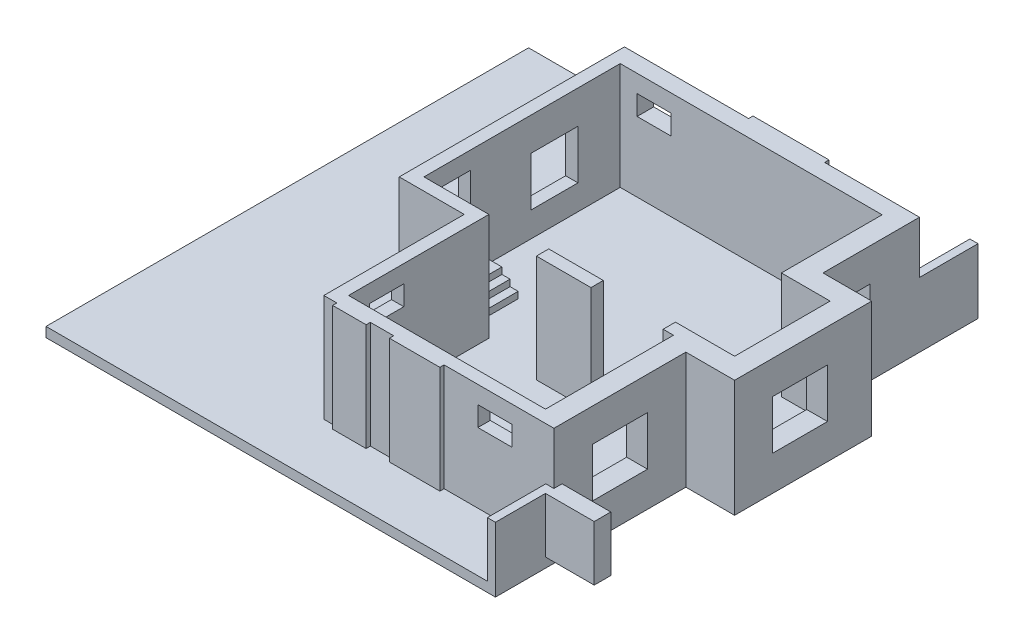
from build123d import *

# Parameters (mm, degrees)
EXTRUDE_1_DEPTH     = 3300
SKETCH_1_W          = 1680
SKETCH_1_H          = 380
EXTRUDE_1_2_DEPTH   = 3300
SKETCH_3_W          = 250
SKETCH_3_H          = 1800
EXTRUDE_2_DEPTH     = 1695
EXTRUDE_3_DEPTH     = 300
SKETCH_5_W          = 1310
SKETCH_5_H          = 2100
SKETCH_5_W_2        = 1440
SKETCH_5_H_2        = 1510
CUT_EXTRUDE_1_DEPTH = 380
SKETCH_6_W          = 1400
SKETCH_6_H          = 1500
EXTRUDE_4_DEPTH     = 200
SKETCH_7_W          = 1150
SKETCH_7_H          = 1500
EXTRUDE_5_DEPTH     = 200
SKETCH_8_W          = 900
SKETCH_8_H          = 1500
EXTRUDE_6_DEPTH     = 200
SKETCH_9_W          = 1440
SKETCH_9_H          = 1510
CUT_EXTRUDE_2_DEPTH = 640
SKETCH_10_W         = 1700
SKETCH_10_H         = 1510
CUT_EXTRUDE_3_DEPTH = 640
SKETCH_11_W         = 1050
SKETCH_11_H         = 610
CUT_EXTRUDE_4_DEPTH = 510
SKETCH_12_W         = 1050
SKETCH_12_H         = 610
CUT_EXTRUDE_5_DEPTH = 380
SKETCH_13_W         = 1050
SKETCH_13_H         = 610
CUT_EXTRUDE_6_DEPTH = 380
SKETCH_14_W         = 1700
SKETCH_14_H         = 1510
CUT_EXTRUDE_7_DEPTH = 640
SKETCH_15_R         = 54
SKETCH_15_R_2       = 38
SKETCH_15_R_3       = 136.5
SKETCH_15_R_4       = 109.5
CUT_EXTRUDE_8_DEPTH = 300


with BuildPart() as part:
    # Эскиз1 → Бобышка-Вытянуть1 (new body)
    with BuildSketch(Plane(origin=(0, 0, 0), x_dir=(1, 0, 0), z_dir=(0, 1, 0))):
        Polygon((-6440, 255), (-10260, 255), (-10260, -6675), (-8260, -6675), (-8260, -10995), (-7860, -10995), (-7860, -11125), (-6830, -11125), (-6830, -10995), (-6110, -10995), (-6110, -11125), (-4560, -11125), (-4560, -10995), (-1180, -10995), (-1180, -6935), (320, -6935), (320, -2715), (-1180, -2715), (-1180, 255), (-4100, 255), (-4100, 390), (-6440, 390), align=None)
        Polygon((-7880, -10615), (-7880, -6675), (-7880, -6295), (-9880, -6295), (-9880, -255), (-1820, -255), (-1820, -3355), (-320, -3355), (-320, -6295), (-2140, -6295), (-2140, -6675), (-1820, -6675), (-1820, -10615), align=None, mode=Mode.SUBTRACT)
    extrude(amount=EXTRUDE_1_DEPTH)

    # Эскиз3 → Бобышка-Вытянуть2 (add)
    with BuildSketch(Plane(origin=(0, 0, 0), x_dir=(1, 0, 0), z_dir=(0, 1, 0))):
        with Locations((-1305, -11895)):
            Rectangle(SKETCH_3_W, SKETCH_3_H)
        Polygon((-1180, -10745), (-1180, -10995), (-1180, -11255), (320, -11255), (320, -10745), align=None)
        with Locations((-1305, 1155)):
            Rectangle(SKETCH_3_W, SKETCH_3_H)
    extrude(amount=EXTRUDE_2_DEPTH)

    # Эскиз4 → Бобышка-Вытянуть3 (add)
    with BuildSketch(Plane(origin=(0, 0, 0), x_dir=(1, 0, 0), z_dir=(0, 1, 0))):
        Polygon((-1180, 2055), (-1180, -2715), (320, -2715), (320, -6935), (-1180, -6935), (-1180, -12795), (-15010, -12795), (-15010, 2055), align=None)
    extrude(amount=-EXTRUDE_3_DEPTH)

    # Эскиз5 → Вырез-Вытянуть1 (cut)
    with BuildSketch(Plane(origin=(-9880, 0, 0), x_dir=(0, 0, -1), z_dir=(1, 0, 0))):
        with Locations((-5510, 1710)):
            Rectangle(SKETCH_5_W, SKETCH_5_H)
        with Locations((-2275, 1525)):
            Rectangle(SKETCH_5_W_2, SKETCH_5_H_2)
    extrude(amount=-CUT_EXTRUDE_1_DEPTH, mode=Mode.SUBTRACT)

    # Эскиз6 → Бобышка-Вытянуть4 (add)
    with BuildSketch(Plane(origin=(0, 0, 0), x_dir=(1, 0, 0), z_dir=(0, 1, 0))):
        with Locations((-9180, -5545)):
            Rectangle(SKETCH_6_W, SKETCH_6_H)
    extrude(amount=EXTRUDE_4_DEPTH)

    # Эскиз7 → Бобышка-Вытянуть5 (add)
    with BuildSketch(Plane(origin=(0, 200, 0), x_dir=(1, 0, 0), z_dir=(0, 1, 0))):
        with Locations((-9305, -5545)):
            Rectangle(SKETCH_7_W, SKETCH_7_H)
    extrude(amount=EXTRUDE_5_DEPTH)

    # Эскиз8 → Бобышка-Вытянуть6 (add)
    with BuildSketch(Plane(origin=(0, 400, 0), x_dir=(1, 0, 0), z_dir=(0, 1, 0))):
        with Locations((-9430, -5545)):
            Rectangle(SKETCH_8_W, SKETCH_8_H)
    extrude(amount=EXTRUDE_6_DEPTH)

    # Эскиз9 → Вырез-Вытянуть2 (cut)
    with BuildSketch(Plane.ZY.offset(1820)):
        with Locations((1995, 1525)):
            Rectangle(SKETCH_9_W, SKETCH_9_H)
    extrude(amount=-CUT_EXTRUDE_2_DEPTH, mode=Mode.SUBTRACT)

    # Эскиз10 → Вырез-Вытянуть3 (cut)
    with BuildSketch(Plane.ZY.offset(1820)):
        with Locations((8965, 1525)):
            Rectangle(SKETCH_10_W, SKETCH_10_H)
    extrude(amount=-CUT_EXTRUDE_3_DEPTH, mode=Mode.SUBTRACT)

    # Эскиз11 → Вырез-Вытянуть4 (cut)
    with BuildSketch(Plane.XY.offset(255)):
        with Locations((-8835, 2455)):
            Rectangle(SKETCH_11_W, SKETCH_11_H)
    extrude(amount=-CUT_EXTRUDE_4_DEPTH, mode=Mode.SUBTRACT)

    # Эскиз12 → Вырез-Вытянуть5 (cut)
    with BuildSketch(Plane(origin=(-7880, 0, 0), x_dir=(0, 0, -1), z_dir=(1, 0, 0))):
        with Locations((-9440, 2455)):
            Rectangle(SKETCH_12_W, SKETCH_12_H)
    extrude(amount=-CUT_EXTRUDE_5_DEPTH, mode=Mode.SUBTRACT)

    # Эскиз13 → Вырез-Вытянуть6 (cut)
    with BuildSketch(Plane(origin=(0, 0, 10615), x_dir=(-1, 0, 0), z_dir=(0, 0, -1))):
        with Locations((2995, 2455)):
            Rectangle(SKETCH_13_W, SKETCH_13_H)
    extrude(amount=-CUT_EXTRUDE_6_DEPTH, mode=Mode.SUBTRACT)

    # Эскиз14 → Вырез-Вытянуть7 (cut)
    with BuildSketch(Plane.ZY.offset(320)):
        with Locations((4925, 1525)):
            Rectangle(SKETCH_14_W, SKETCH_14_H)
    extrude(amount=-CUT_EXTRUDE_7_DEPTH, mode=Mode.SUBTRACT)

    # Эскиз15 → Вырез-Вытянуть8 (cut)
    with BuildSketch(Plane(origin=(0, 0, 0), x_dir=(1, 0, 0), z_dir=(0, 1, 0))):
        with Locations(Location((-7680, -9355, 0), (0, 0, 270))):
            Circle(SKETCH_15_R)
        with Locations(Location((-7680, -9605, 0), (0, 0, 270))):
            Circle(SKETCH_15_R_2)
        with Locations(Location((-5850, -10365, 0), (0, 0, 270))):
            Circle(SKETCH_15_R_3)
        with Locations(Location((-5500, -10365, 0), (0, 0, 270))):
            Circle(SKETCH_15_R_3)
        with Locations(Location((-2850, -10365, 0), (0, 0, 270))):
            Circle(SKETCH_15_R_4)
        with Locations(Location((-2500, -10365, 0), (0, 0, 270))):
            Circle(SKETCH_15_R_4)
        with Locations(Location((-7680, -9105, 0), (0, 0, 270))):
            Circle(SKETCH_15_R)
    extrude(amount=-CUT_EXTRUDE_8_DEPTH, mode=Mode.SUBTRACT)


with BuildPart() as body_2:
    # Эскиз1 → Extrude 1 2 (new body)
    with BuildSketch(Plane(origin=(0, 0, 0), x_dir=(1, 0, 0), z_dir=(0, 1, 0))):
        with Locations((-5200, -6485)):
            Rectangle(SKETCH_1_W, SKETCH_1_H)
    extrude(amount=EXTRUDE_1_2_DEPTH)


solid = Compound([part.part, body_2.part])
